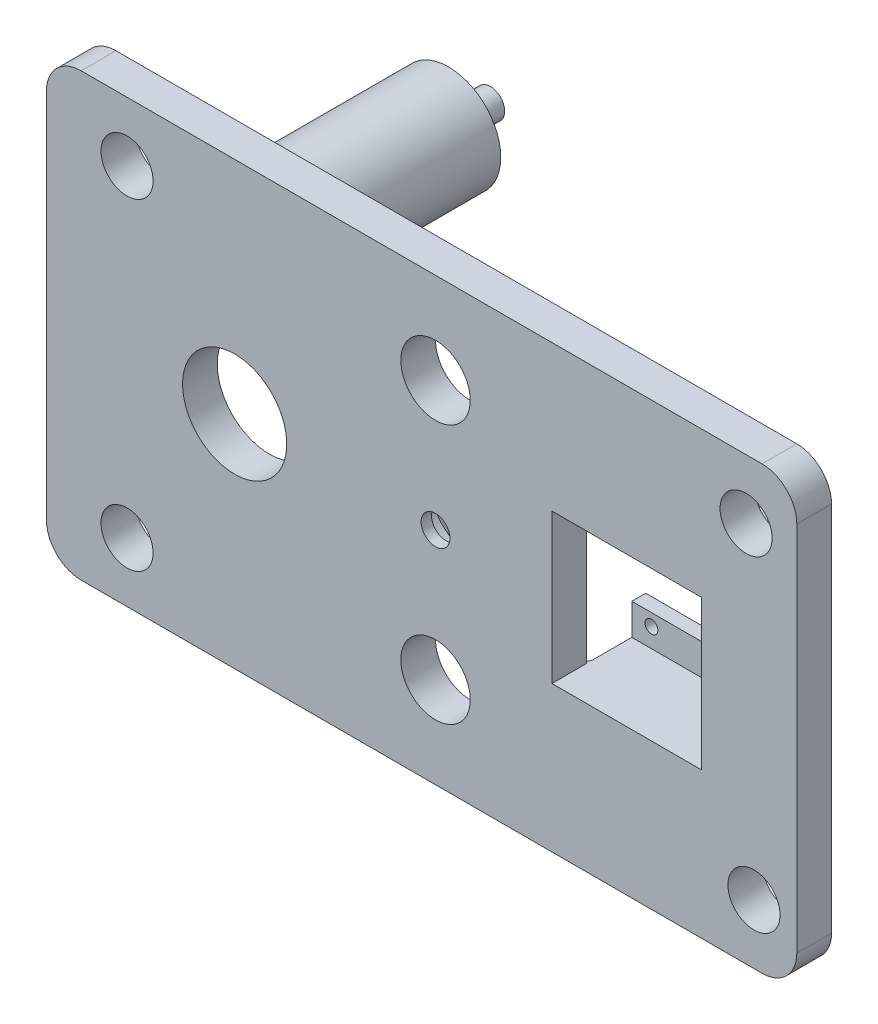
from build123d import *

# Parameters (mm, degrees)
SKETCH1_W            = 216
SKETCH1_H            = 127
BOSS_EXTRUDE1_DEPTH  = 10
FILLET1_R            = 10
FILLET2_R            = 10
SKETCH9_R            = 11.15
CUT_EXTRUDE4_DEPTH   = 7
SKETCH12_R           = 4.15
CUT_EXTRUDE5_DEPTH   = 7
SKETCH9_4_W          = 43
SKETCH9_4_H          = 43
CUT_EXTRUDE6_DEPTH   = 126.683133315
SKETCH13_W           = 43
SKETCH13_H           = 4
BOSS_EXTRUDE2_DEPTH  = 17
FILLET4_R            = 2
SKETCH17_W           = 43
SKETCH17_H           = 4
BOSS_EXTRUDE5_DEPTH  = 9
SKETCH18_W           = 43
SKETCH18_H           = 4
BOSS_EXTRUDE6_DEPTH  = 17
SKETCH19_W           = 43
SKETCH19_H           = 4
BOSS_EXTRUDE7_DEPTH  = 9
FILLET5_R            = 2
SKETCH20_R           = 1.85
CUT_EXTRUDE7_DEPTH   = 9
SKETCH23_R           = 1.85
CUT_EXTRUDE8_DEPTH   = 9
SKETCH25_R           = 15
BOSS_EXTRUDE9_DEPTH  = 48.84
SKETCH26_R           = 4.15
BOSS_EXTRUDE10_DEPTH = 12
SKETCH27_R           = 4.15
BOSS_EXTRUDE11_DEPTH = 12
FILLET9_R            = 2
FILLET10_R           = 2
SKETCH28_R           = 7.5
CUT_EXTRUDE9_DEPTH   = 144.925521017
SKETCH29_R           = 10
SKETCH29_R_2         = 15
CUT_EXTRUDE10_DEPTH  = 140.275825612


with BuildPart() as part:
    # Sketch1 → Boss-Extrude1 (new body)
    with BuildSketch(Plane.XY):
        Rectangle(SKETCH1_W, SKETCH1_H)
    extrude(amount=BOSS_EXTRUDE1_DEPTH)

    # Fillet1
    fillet1_edges = [part.edges().sort_by_distance(p)[0] for p in [
        (-108, 63.5, 5),
    ]]
    fillet(fillet1_edges, radius=FILLET1_R)

    # Fillet2
    fillet2_edges = [part.edges().sort_by_distance(p)[0] for p in [
        (-108, -63.5, 5),
        (108, 63.5, 5),
        (108, -63.5, 5),
    ]]
    fillet(fillet2_edges, radius=FILLET2_R)

    # Sketch9 → Cut-Extrude4 (cut)
    with BuildSketch(Plane(origin=(0, 0, 0), x_dir=(-1, 0, 0), z_dir=(0, 0, -1))):
        with Locations((-4, 0)):
            Circle(SKETCH9_R)
    extrude(amount=-CUT_EXTRUDE4_DEPTH, mode=Mode.SUBTRACT)

    # Sketch12 → Cut-Extrude5 (cut)
    with BuildSketch(Plane(origin=(0, 0, 7), x_dir=(-1, 0, 0), z_dir=(0, 0, -1))):
        with Locations((-4, 0)):
            Circle(SKETCH12_R)
    extrude(amount=-CUT_EXTRUDE5_DEPTH, mode=Mode.SUBTRACT)

    # Sketch9<4> → Cut-Extrude6 (cut, through all)
    with BuildSketch(Plane(origin=(0, 0, 0), x_dir=(-1, 0, 0), z_dir=(0, 0, -1))):
        with Locations((-59, 0)):
            Rectangle(SKETCH9_4_W, SKETCH9_4_H)
    extrude(amount=-CUT_EXTRUDE6_DEPTH, mode=Mode.SUBTRACT)

    # Sketch13 → Boss-Extrude2 (add)
    with BuildSketch(Plane(origin=(0, 0, 0), x_dir=(-1, 0, 0), z_dir=(0, 0, -1))):
        with Locations((-59, -23.5)):
            Rectangle(SKETCH13_W, SKETCH13_H)
    extrude(amount=BOSS_EXTRUDE2_DEPTH)

    # Fillet4
    fillet4_edges = [part.edges().sort_by_distance(p)[0] for p in [
        (59, -25.5, 0),
        (37.5, -23.5, 0),
        (80.5, -23.5, 0),
    ]]
    fillet(fillet4_edges, radius=FILLET4_R)

    # Sketch17 → Boss-Extrude5 (add)
    with BuildSketch(Plane(origin=(0, -21.5, 0), x_dir=(1, 0, 0), z_dir=(0, 1, 0))):
        with Locations((59, 15)):
            Rectangle(SKETCH17_W, SKETCH17_H)
    extrude(amount=BOSS_EXTRUDE5_DEPTH)

    # Sketch18 → Boss-Extrude6 (add)
    with BuildSketch(Plane(origin=(0, 0, 0), x_dir=(-1, 0, 0), z_dir=(0, 0, -1))):
        with Locations((-59, 23.5)):
            Rectangle(SKETCH18_W, SKETCH18_H)
    extrude(amount=BOSS_EXTRUDE6_DEPTH)

    # Sketch19 → Boss-Extrude7 (add)
    with BuildSketch(Plane(origin=(0, 21.5, 0), x_dir=(-1, 0, 0), z_dir=(0, -1, 0))):
        with Locations((-59, 15)):
            Rectangle(SKETCH19_W, SKETCH19_H)
    extrude(amount=BOSS_EXTRUDE7_DEPTH)

    # Fillet5
    fillet5_edges = [part.edges().sort_by_distance(p)[0] for p in [
        (37.5, 23.5, 0),
        (80.5, 23.5, 0),
        (59, 25.5, 0),
    ]]
    fillet(fillet5_edges, radius=FILLET5_R)

    # Sketch20 → Cut-Extrude7 (cut)
    with BuildSketch(Plane(origin=(0, 0, -17), x_dir=(-1, 0, 0), z_dir=(0, 0, -1))):
        with Locations((-43.15, -16)):
            Circle(SKETCH20_R)
        with Locations((-74.85, -16)):
            Circle(SKETCH20_R)
    extrude(amount=-CUT_EXTRUDE7_DEPTH, mode=Mode.SUBTRACT)

    # Sketch23 → Cut-Extrude8 (cut)
    with BuildSketch(Plane(origin=(0, 0, -17), x_dir=(-1, 0, 0), z_dir=(0, 0, -1))):
        with Locations((-43.15, 15.85)):
            Circle(SKETCH23_R)
        with Locations((-74.85, 16)):
            Circle(SKETCH23_R)
    extrude(amount=-CUT_EXTRUDE8_DEPTH, mode=Mode.SUBTRACT)

    # Sketch25 → Boss-Extrude9 (add)
    with BuildSketch(Plane(origin=(0, 0, 0), x_dir=(-1, 0, 0), z_dir=(0, 0, -1))):
        with Locations((51.068737931, -43.5)):
            Circle(SKETCH25_R)
        with Locations((51.068737931, 43.5)):
            Circle(SKETCH25_R)
    extrude(amount=BOSS_EXTRUDE9_DEPTH)

    # Sketch26 → Boss-Extrude10 (add)
    with BuildSketch(Plane(origin=(0, 0, -48.84), x_dir=(-1, 0, 0), z_dir=(0, 0, -1))):
        with Locations((51.068737931, -43.5)):
            Circle(SKETCH26_R)
    extrude(amount=BOSS_EXTRUDE10_DEPTH)

    # Sketch27 → Boss-Extrude11 (add)
    with BuildSketch(Plane(origin=(0, 0, -48.84), x_dir=(-1, 0, 0), z_dir=(0, 0, -1))):
        with Locations((51.068737931, 43.5)):
            Circle(SKETCH27_R)
    extrude(amount=BOSS_EXTRUDE11_DEPTH)

    # Fillet9
    fillet9_edges = [part.edges().sort_by_distance(p)[0] for p in [
        (-36.068737931, -43.5, 0),
    ]]
    fillet(fillet9_edges, radius=FILLET9_R)

    # Fillet10
    fillet10_edges = [part.edges().sort_by_distance(p)[0] for p in [
        (-36.068737931, 43.5, 0),
    ]]
    fillet(fillet10_edges, radius=FILLET10_R)

    # Sketch28 → Cut-Extrude9 (cut, through all)
    with BuildSketch(Plane.XY.offset(10)):
        with Locations((-84.811667967, 46.37)):
            Circle(SKETCH28_R)
        with Locations((-84.811667967, -46.37)):
            Circle(SKETCH28_R)
        with Locations((95.674047271, -46.369786546)):
            Circle(SKETCH28_R)
        with Locations((93.399057455, 46.37)):
            Circle(SKETCH28_R)
    extrude(amount=-CUT_EXTRUDE9_DEPTH, mode=Mode.SUBTRACT)

    # Sketch29 → Cut-Extrude10 (cut, through all)
    with BuildSketch(Plane(origin=(0, 0, 0), x_dir=(-1, 0, 0), z_dir=(0, 0, -1))):
        with Locations((-4, 37.325)):
            Circle(SKETCH29_R)
        with Locations((53.828265838, 0)):
            Circle(SKETCH29_R_2)
        with Locations((-4, -37.325)):
            Circle(SKETCH29_R)
    extrude(amount=-CUT_EXTRUDE10_DEPTH, mode=Mode.SUBTRACT)


solid = part.part
